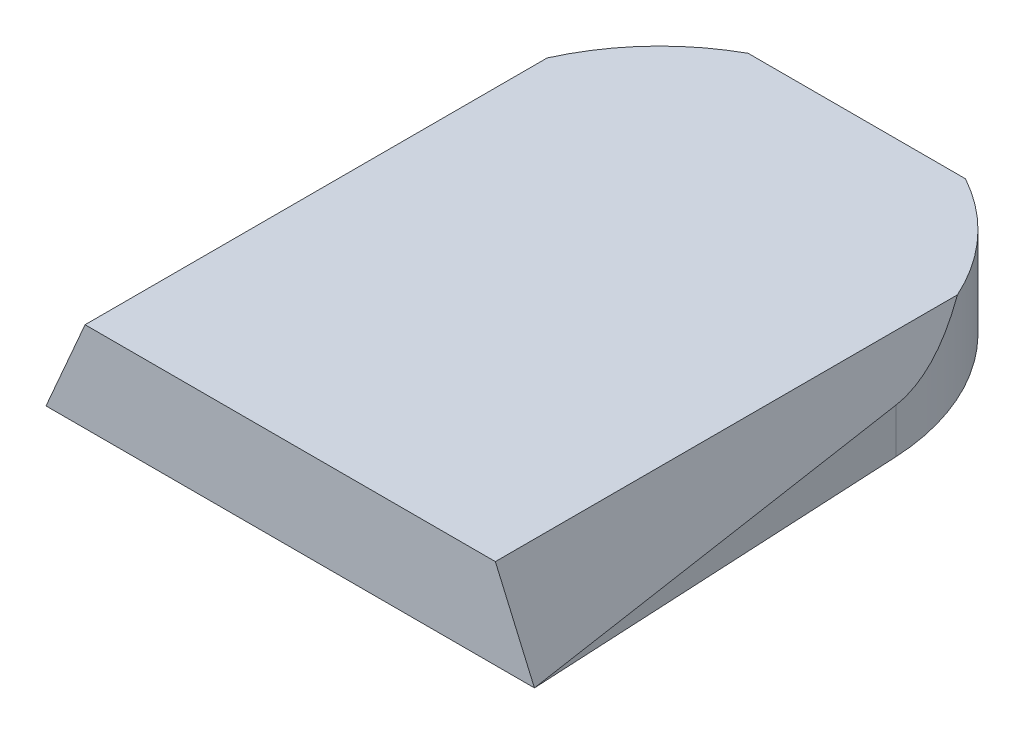
from build123d import *

# Parameters (mm, degrees)
EXTRUDE_1_DEPTH     = 4.6
CUT_EXTRUDE_1_DEPTH = 33.561472769


with BuildPart() as part:
    # 草图1 → 凸台-拉伸1 (new body)
    with BuildSketch(Plane(origin=(0, 0, 0), x_dir=(1, 0, 0), z_dir=(0, 1, 0))):
        with BuildLine():
            Line((-10.925572519, 0), (14.074427481, 0))
            Line((14.074427481, 0), (13.078683741, 19.499891752))
            ThreePointArc((13.078683741, 19.499891752), (11.340488735, 25.021206932), (7.136270744, 29))
            Line((7.136270744, 29), (-3.987415782, 29))
            ThreePointArc((-3.987415782, 29), (-8.191633773, 25.021206932), (-9.929828779, 19.499891752))
            Line((-9.929828779, 19.499891752), (-10.925572519, 0))
        make_face()
    extrude(amount=EXTRUDE_1_DEPTH)

    # 草图6 → 切除-拉伸1 (cut, through all)
    with BuildSketch(Plane.XY):
        Polygon((-10.925572519, 0), (-8.925572519, 4.6), (-10.925572519, 4.6), align=None)
        Polygon((12.074427481, 4.6), (14.074427481, 4.6), (14.074427481, 0), align=None)
    extrude(amount=-CUT_EXTRUDE_1_DEPTH, mode=Mode.SUBTRACT)


solid = part.part
